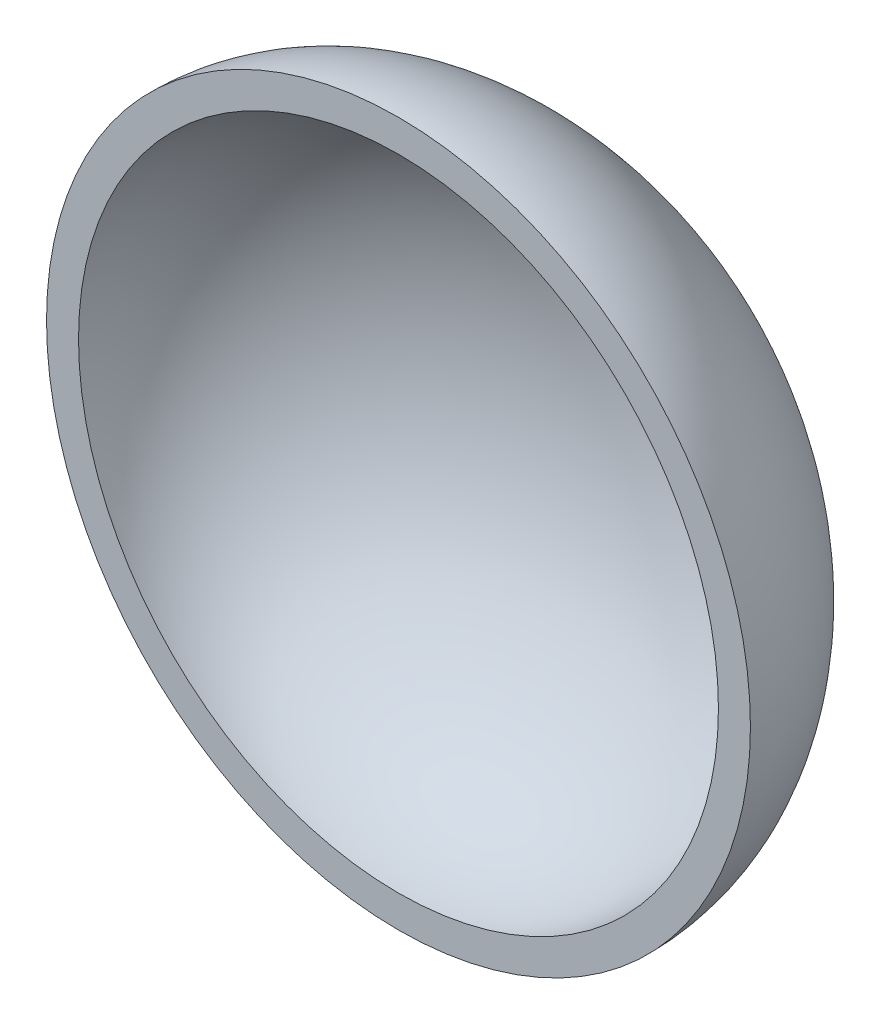
from build123d import *


with BuildPart() as part:
    # 草图1 → 旋转1 (revolve)
    with BuildSketch(Plane(origin=(0, 0, 0), x_dir=(1, 0, 0), z_dir=(0, 1, 0))):
        with BuildLine():
            Line((-22, 0), (-20, 0))
            add(Edge.make_bspline(
                [(0, 14), (-20, 14), (-20, 0)],
                knots=[1.570796327, 1.570796327, 1.570796327, 3.141592654, 3.141592654, 3.141592654], degree=2, weights=[1, 0.707106781, 1]))
            Line((0, 14), (0, 16))
            add(Edge.make_bspline(
                [(0, 16), (-22, 16), (-22, 0)],
                knots=[1.570796327, 1.570796327, 1.570796327, 3.141592654, 3.141592654, 3.141592654], degree=2, weights=[1, 0.707106781, 1]))
        make_face()
    revolve(axis=Axis((0, 0, -16), (0, 0, 1)))


solid = part.part
